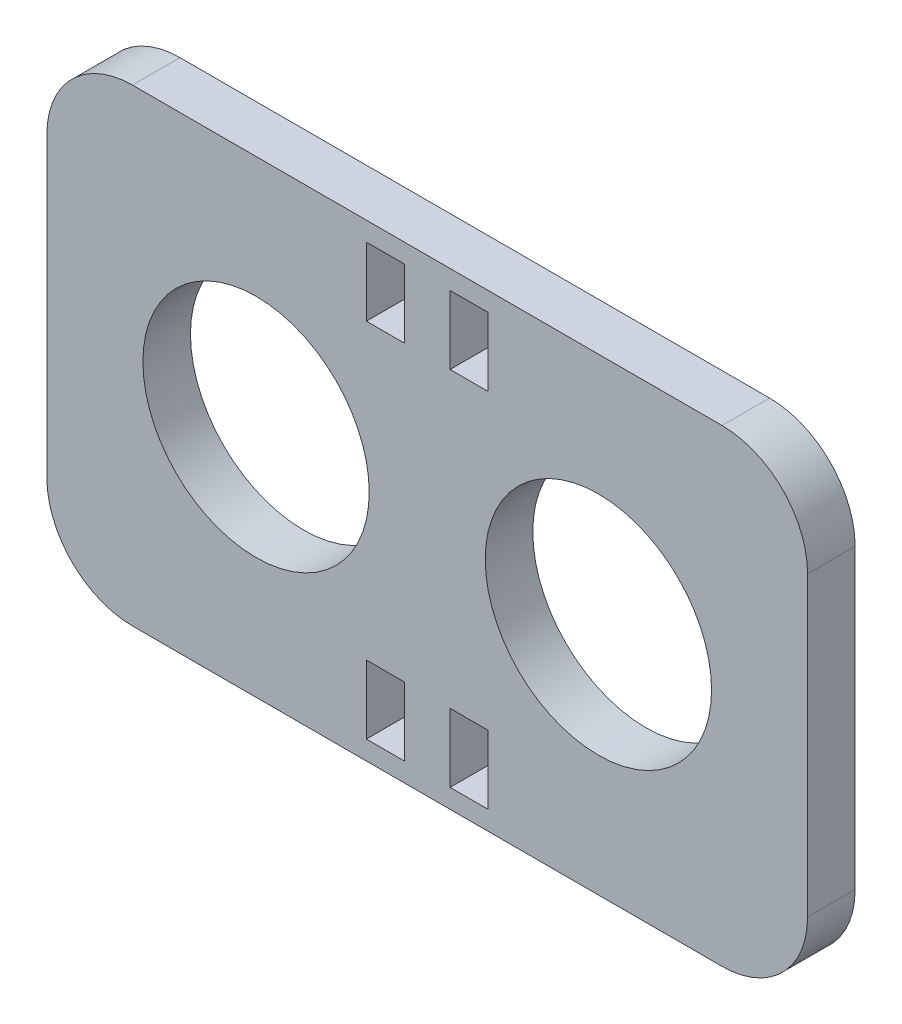
from build123d import *

# Parameters (mm, degrees)
SKETCH1_R           = 7.5565
SKETCH1_W           = 2.54
SKETCH1_H           = 4.572
BOSS_EXTRUDE1_DEPTH = 3.175


with BuildPart() as part:
    # Sketch1 → Boss-Extrude1 (new body)
    with BuildSketch(Plane.XY):
        with BuildLine():
            Line((-8.255, 15.639992312), (31.115, 15.639992312))
            ThreePointArc((31.115, 15.639992312), (35.156115254, 13.966107566), (36.83, 9.924992312))
            Line((36.83, 9.924992312), (36.83, -9.924992312))
            ThreePointArc((36.83, -9.924992312), (35.156115254, -13.966107566), (31.115, -15.639992312))
            Line((31.115, -15.639992312), (-8.255, -15.639992312))
            ThreePointArc((-8.255, -15.639992312), (-12.296115254, -13.966107566), (-13.97, -9.924992312))
            Line((-13.97, -9.924992312), (-13.97, 9.924992312))
            ThreePointArc((-13.97, 9.924992312), (-12.296115254, 13.966107566), (-8.255, 15.639992312))
        make_face()
        Circle(SKETCH1_R, mode=Mode.SUBTRACT)
        with Locations((22.86, 0)):
            Circle(SKETCH1_R, mode=Mode.SUBTRACT)
        with Locations((8.636, 12.083992312)):
            Rectangle(SKETCH1_W, SKETCH1_H, mode=Mode.SUBTRACT)
        with Locations((14.224, 12.083992312)):
            Rectangle(SKETCH1_W, SKETCH1_H, mode=Mode.SUBTRACT)
        with Locations((14.224, -12.083992312)):
            Rectangle(SKETCH1_W, SKETCH1_H, mode=Mode.SUBTRACT)
        with Locations((8.636, -12.083992312)):
            Rectangle(SKETCH1_W, SKETCH1_H, mode=Mode.SUBTRACT)
    extrude(amount=BOSS_EXTRUDE1_DEPTH)


solid = part.part
